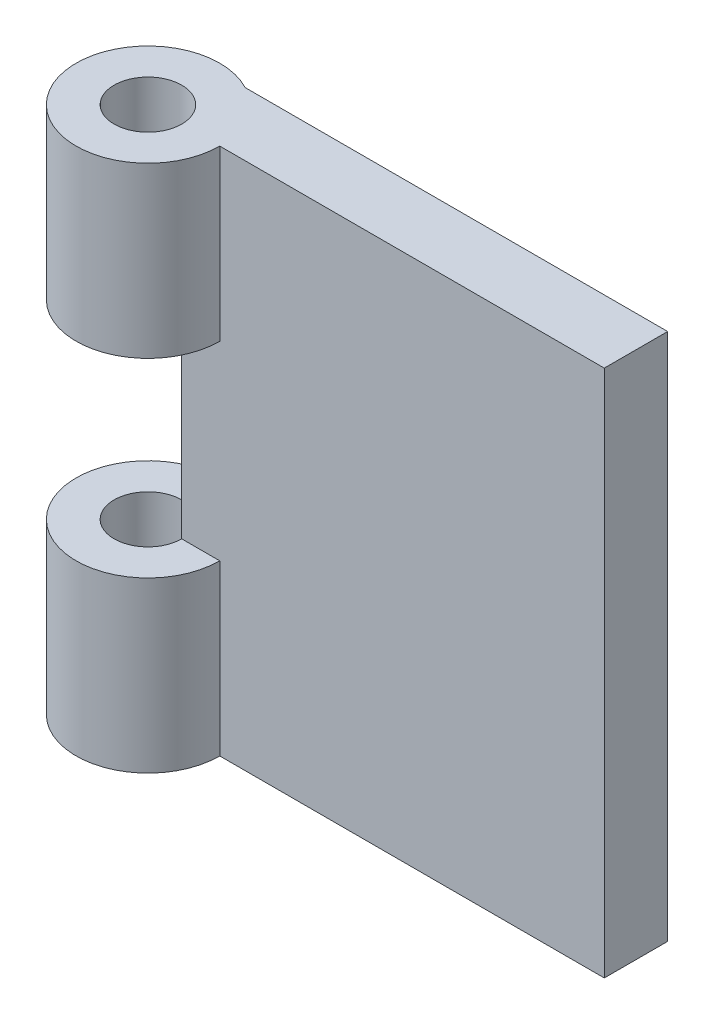
from build123d import *

# Parameters (mm, degrees)
SKETCH2_W           = 25
SKETCH2_H           = 20
BOSS_EXTRUDE1_DEPTH = 3
SKETCH3_R           = 3.4
SKETCH3_R_2         = 1.6
BOSS_EXTRUDE2_DEPTH = 8
LPATTERN1_COUNT     = 2
LPATTERN1_PITCH     = 17


with BuildPart() as part:
    # Sketch2 → Boss-Extrude1 (new body)
    with BuildSketch(Plane(origin=(0, 0, 0), x_dir=(0, 1, 0), z_dir=(0, 0, 1))):
        Rectangle(SKETCH2_W, SKETCH2_H)
    extrude(amount=BOSS_EXTRUDE1_DEPTH)

    # Sketch3 → Boss-Extrude2 (add)
    with BuildSketch(Plane(origin=(22.5, 12.5, 0), x_dir=(-1, 0, 0), z_dir=(0, 1, 0))):
        with Locations((34.1, 3)):
            Circle(SKETCH3_R)
        with Locations(Location((34.1, 3, 0), (0, 0, 90))):
            Circle(SKETCH3_R_2, mode=Mode.SUBTRACT)
    boss_extrude2 = extrude(amount=-BOSS_EXTRUDE2_DEPTH)

    # LPattern1: Boss-Extrude2 ×2
    with Locations(*[(0, -i * LPATTERN1_PITCH, 0) for i in range(1, LPATTERN1_COUNT)]):
        add(boss_extrude2)


solid = part.part
